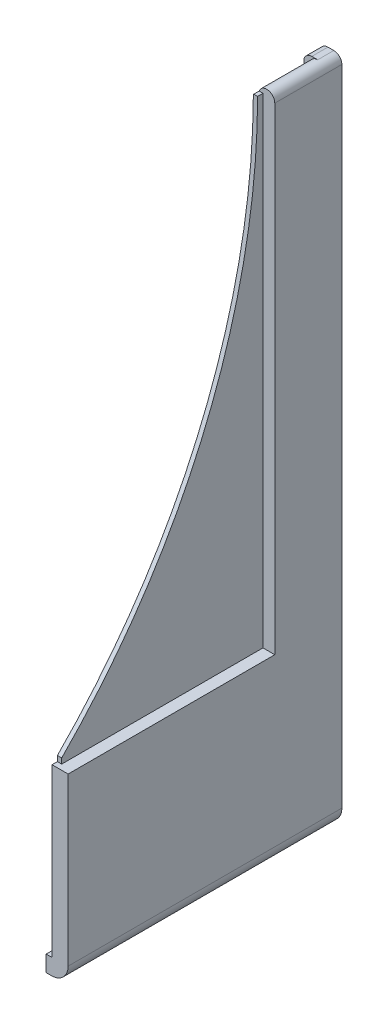
from build123d import *

# Parameters (mm, degrees)
CROQUIS1_W              = 1
CROQUIS1_H              = 3
SALIENTE_EXTRUIR1_DEPTH = 48
SALIENTE_EXTRUIR2_START = 3
SALIENTE_EXTRUIR2_DEPTH = 3
CROQUIS3_W              = 38.5
CROQUIS3_H              = 90.5
CORTAR_EXTRUIR1_DEPTH   = 2.2
CROQUIS4_W              = 1
CROQUIS4_H              = 0.826649916
CORTAR_EXTRUIR2_DEPTH   = 131.749378584


with BuildPart() as part:
    # Croquis1 → Saliente-Extruir1 (new body)
    with BuildSketch(Plane.XY):
        with BuildLine():
            ThreePointArc((1.1, 120.1), (2.6, 121.6), (4.1, 120.1))
            Line((4.1, 120.1), (4.1, 0.1))
            Line((4.1, 0.1), (1.1, 0.1))
            Line((1.1, 0.1), (1.1, 120.1))
        make_face()
        with BuildLine():
            Line((1, 0), (1, -3))
            ThreePointArc((1, -3), (3.192031022, -2.092031022), (4.1, 0.1))
            Line((4.1, 0.1), (1.1, 0.1))
            ThreePointArc((1.1, 0.1), (1.070710678, 0.029289322), (1, 0))
        make_face()
        with Locations((0.5, -1.5)):
            Rectangle(CROQUIS1_W, CROQUIS1_H)
    extrude(amount=SALIENTE_EXTRUIR1_DEPTH)

    # Croquis2 → Saliente-Extruir2 (add)
    with BuildSketch(Plane(origin=(0, 0, 0), x_dir=(-1, 0, 0), z_dir=(0, 0, -1)).offset(SALIENTE_EXTRUIR2_START)):
        with BuildLine():
            Line((-1, -3), (0, -3))
            Line((0, -3), (0, 120.1))
            ThreePointArc((0, 120.1), (-0.439339828, 121.160660172), (-1.5, 121.6))
            Line((-1.5, 121.6), (-2.6, 121.6))
            ThreePointArc((-2.6, 121.6), (-3.660660172, 121.160660172), (-4.1, 120.1))
            Line((-4.1, 120.1), (-4.1, 0.1))
            ThreePointArc((-4.1, 0.1), (-3.192031022, -2.092031022), (-1, -3))
        make_face()
    extrude(amount=-SALIENTE_EXTRUIR2_DEPTH)

    # Croquis3 → Cortar-Extruir1 (cut)
    with BuildSketch(Plane(origin=(4.1, 0, 0), x_dir=(0, 0, -1), z_dir=(1, 0, 0))):
        with Locations((-28.75, 76.35)):
            Rectangle(CROQUIS3_W, CROQUIS3_H)
    extrude(amount=-CORTAR_EXTRUIR1_DEPTH, mode=Mode.SUBTRACT)

    # Croquis4 → Cortar-Extruir2 (cut, through all)
    with BuildSketch(Plane(origin=(1.9, 0, 0), x_dir=(0, 0, -1), z_dir=(1, 0, 0))):
        with BuildLine():
            Line((-10.5, 120.6), (-10.5, 121.426649916))
            Line((-10.5, 121.426649916), (-48, 121.426649916))
            Line((-48, 121.426649916), (-48, 31.1))
            Line((-48, 31.1), (-47, 31.1))
            Line((-47, 31.1), (-47, 32.1))
            ThreePointArc((-47, 32.1), (-19.983171743, 72.73430247), (-10.5, 120.6))
        make_face()
        with Locations((-10, 121.013324958)):
            Rectangle(CROQUIS4_W, CROQUIS4_H)
    extrude(amount=-CORTAR_EXTRUIR2_DEPTH, mode=Mode.SUBTRACT)


solid = part.part
